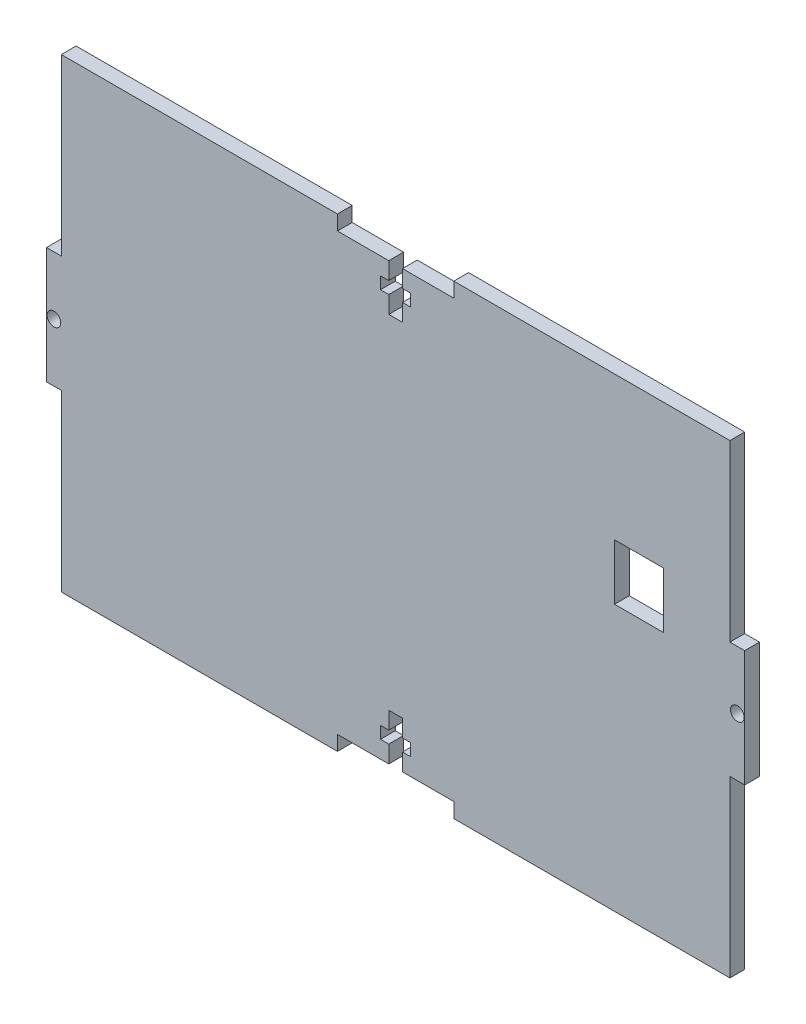
from build123d import *

# Parameters (mm, degrees)
SKETCH1_R           = 1.47
BOSS_EXTRUDE1_DEPTH = 1.5875
SKETCH3_W           = 10.5
SKETCH3_H           = 12
CUT_EXTRUDE1_DEPTH  = 91.1946818


with BuildPart() as part:
    # Sketch1 → Boss-Extrude1 (new, symmetric)
    with BuildSketch(Plane.XY):
        Polygon((-12.5, 50), (-71.825, 50), (-71.825, 12.5), (-75, 12.5), (-75, -12.5), (-71.825, -12.5), (-71.825, -50), (-12.5, -50), (-12.5, -46.825), (-1.47, -46.825), (-1.47, -43.125), (-3.25, -43.125), (-3.25, -40.525), (-1.47, -40.525), (-1.47, -36.825), (1.47, -36.825), (1.47, -40.525), (3.25, -40.525), (3.25, -43.125), (1.47, -43.125), (1.47, -46.825), (12.5, -46.825), (12.5, -50), (71.825, -50), (71.825, -12.5), (75, -12.5), (75, 12.5), (71.825, 12.5), (71.825, 50), (12.5, 50), (12.5, 46.825), (1.47, 46.825), (1.47, 43.125), (3.25, 43.125), (3.25, 40.525), (1.47, 40.525), (1.47, 36.825), (-1.47, 36.825), (-1.47, 40.525), (-3.25, 40.525), (-3.25, 43.125), (-1.47, 43.125), (-1.47, 46.825), (-12.5, 46.825), align=None)
        with Locations((-73.4125, 0)):
            Circle(SKETCH1_R, mode=Mode.SUBTRACT)
        with Locations(Location((73.4125, 0, 0), (0, 0, 180))):
            Circle(SKETCH1_R, mode=Mode.SUBTRACT)
    extrude(amount=BOSS_EXTRUDE1_DEPTH, both=True)

    # Sketch3 → Cut-Extrude1 (cut, through all)
    with BuildSketch(Plane(origin=(0, 0, -1.5875), x_dir=(-1, 0, 0), z_dir=(0, 0, -1))):
        with Locations((-52.275, 13.144805742)):
            Rectangle(SKETCH3_W, SKETCH3_H)
    extrude(amount=-CUT_EXTRUDE1_DEPTH, mode=Mode.SUBTRACT)


solid = part.part
